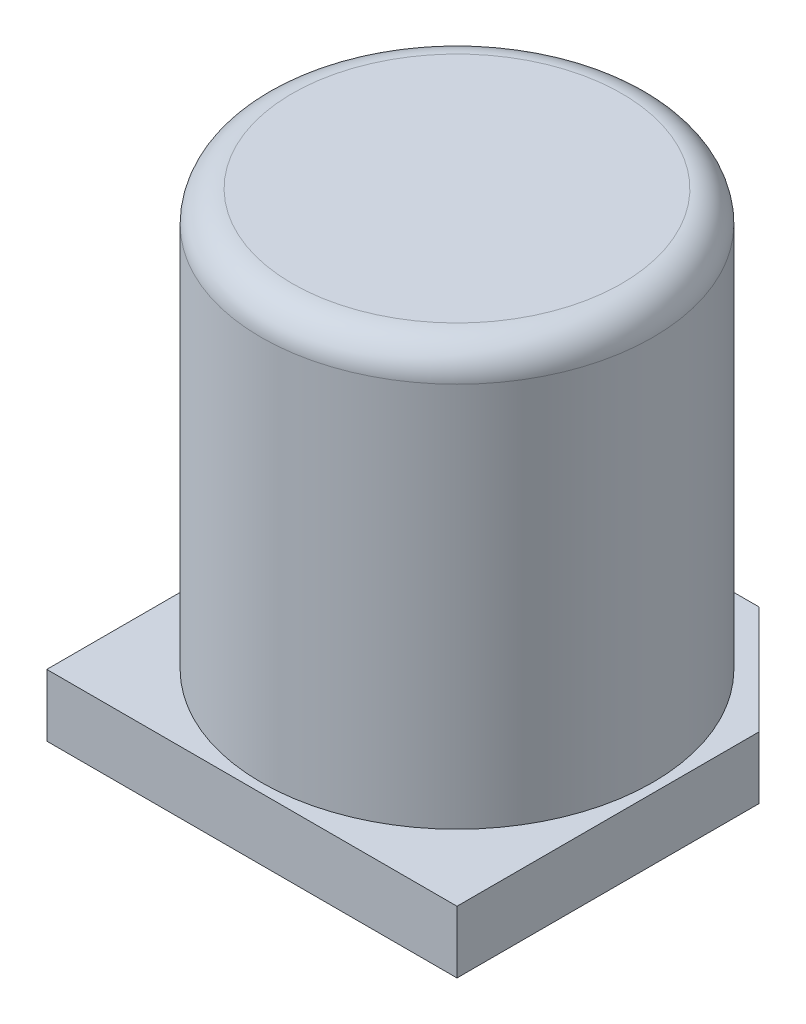
from build123d import *

# Parameters (mm, degrees)
ESBO_O1_W                = 6.6
ESBO_O1_H                = 6.6
RESSALTO_EXTRUS_O1_DEPTH = 1
ESBO_O2_W                = 3.15
ESBO_O2_H                = 6.7
CHANFRO1_SIZE            = 1.737451731
FILETE1_R                = 0.5


with BuildPart() as part:
    # Esboço1 → Ressalto-extrusão1 (new body)
    with BuildSketch(Plane.XZ):
        Rectangle(ESBO_O1_W, ESBO_O1_H)
    extrude(amount=-RESSALTO_EXTRUS_O1_DEPTH)

    # Esboço2 → Revolução1 (revolve)
    with BuildSketch(Plane.XY, mode=Mode.PRIVATE) as revolu_o1_sk:
        with Locations((1.575, 4.35)):
            Rectangle(ESBO_O2_W, ESBO_O2_H)
    revolve(revolu_o1_sk.sketch.rotate(Axis((0, 7.7, 0), (0, -1, 0)), 270), axis=Axis((0, 7.7, 0), (0, -1, 0)))

    # Chanfro1
    chanfro1_edges = [part.edges().sort_by_distance(p)[0] for p in [
        (3.3, 0.5, -3.3),
        (-3.3, 0.5, -3.3),
    ]]
    chamfer(chanfro1_edges, length=CHANFRO1_SIZE)

    # Filete1
    filete1_edges = [part.edges().sort_by_distance(p)[0] for p in [
        (0, 7.7, 3.15),
    ]]
    fillet(filete1_edges, radius=FILETE1_R)


solid = part.part
